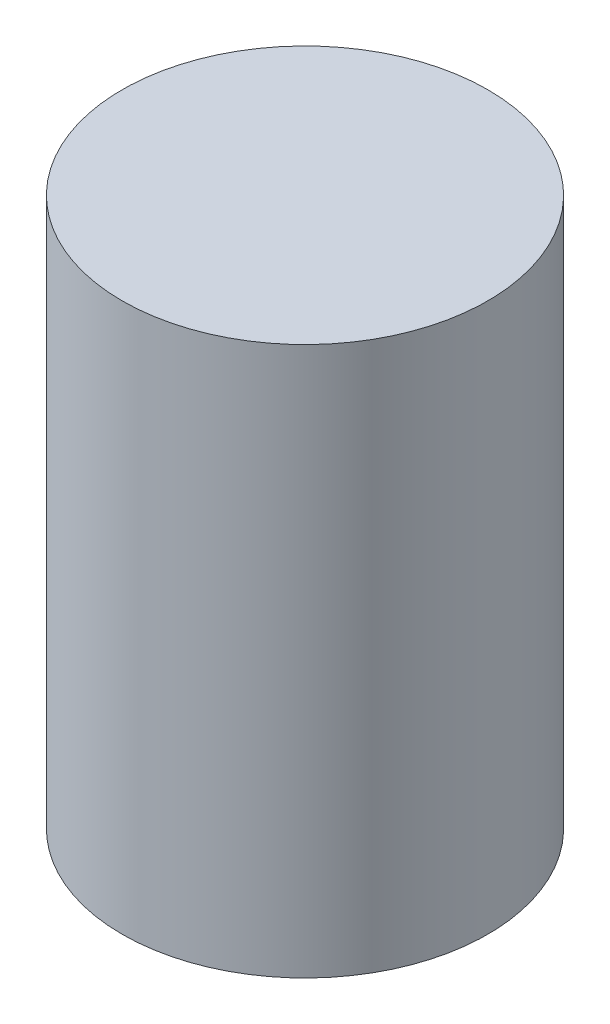
from build123d import *

# Parameters (mm, degrees)
SKETCH1_R           = 3.175
BOSS_EXTRUDE1_DEPTH = 9.525


with BuildPart() as part:
    # Sketch1 → Boss-Extrude1 (new body)
    with BuildSketch(Plane(origin=(0, 0, 0), x_dir=(1, 0, 0), z_dir=(0, 1, 0))):
        with Locations(Location((0, 0, 0), (0, 0, 90))):
            Circle(SKETCH1_R)
    extrude(amount=BOSS_EXTRUDE1_DEPTH)


solid = part.part
